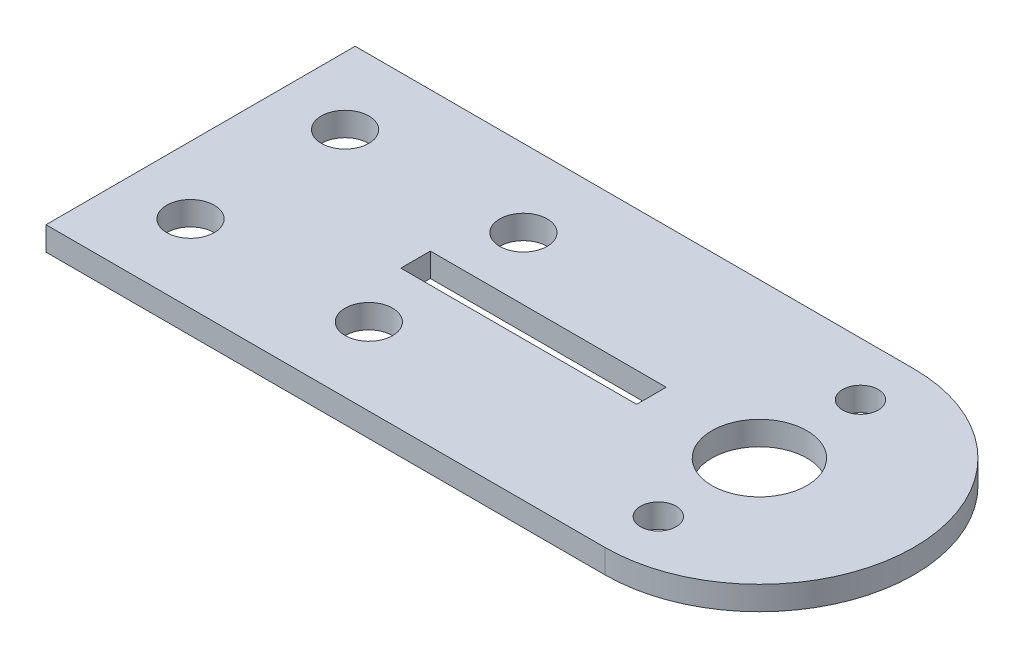
from build123d import *

# Parameters (mm, degrees)
SKETCH3_R           = 2
SKETCH3_R_2         = 1.5
SKETCH3_R_3         = 4
BOSS_EXTRUDE1_DEPTH = 2
SKETCH6_W           = 19.838520206
SKETCH6_H           = 2.488043404
CUT_EXTRUDE1_DEPTH  = 50


with BuildPart() as part:
    # Sketch3 → Boss-Extrude1 (new body)
    with BuildSketch(Plane(origin=(0, 0, 0), x_dir=(1, 0, 0), z_dir=(0, 1, 0))):
        with BuildLine():
            Line((17, 13), (-30, 13))
            Line((-30, 13), (-30, -13))
            Line((-30, -13), (17, -13))
            ThreePointArc((17, -13), (30, 0), (17, 13))
        make_face()
        with Locations(Location((-24.346479472, -6.5, 0), (0, 0, 270))):
            Circle(SKETCH3_R, mode=Mode.SUBTRACT)
        with Locations(Location((-9.346479472, -6.5, 0), (0, 0, 270))):
            Circle(SKETCH3_R, mode=Mode.SUBTRACT)
        with Locations(Location((-9.346479472, 6.5, 0), (0, 0, 270))):
            Circle(SKETCH3_R, mode=Mode.SUBTRACT)
        with Locations(Location((-24.346479472, 6.5, 0), (0, 0, 270))):
            Circle(SKETCH3_R, mode=Mode.SUBTRACT)
        with Locations(Location((17, -8.5, 0), (0, 0, 270))):
            Circle(SKETCH3_R_2, mode=Mode.SUBTRACT)
        with Locations(Location((17, 8.5, 0), (0, 0, 270))):
            Circle(SKETCH3_R_2, mode=Mode.SUBTRACT)
        with Locations(Location((17, 0, 0), (0, 0, 270))):
            Circle(SKETCH3_R_3, mode=Mode.SUBTRACT)
    extrude(amount=BOSS_EXTRUDE1_DEPTH)

    # Sketch6 → Cut-Extrude1 (cut)
    with BuildSketch(Plane(origin=(0, 2, 0), x_dir=(1, 0, 0), z_dir=(0, 1, 0))):
        with Locations((-2, 0)):
            Rectangle(SKETCH6_W, SKETCH6_H)
    extrude(amount=-CUT_EXTRUDE1_DEPTH, mode=Mode.SUBTRACT)


solid = part.part
